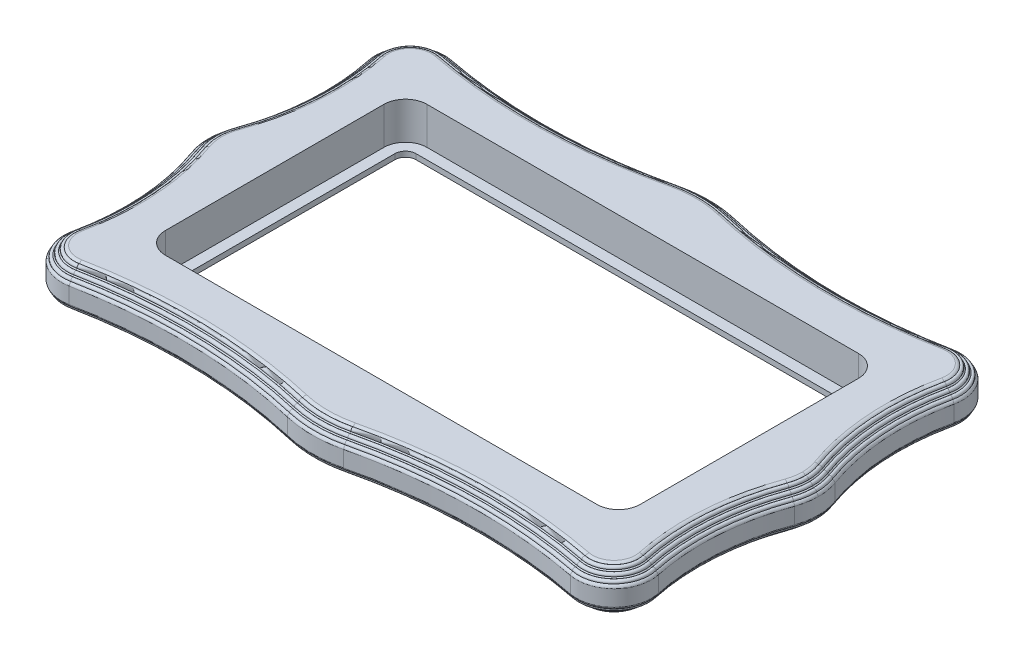
from build123d import *

# Parameters (mm, degrees)
SKETCH1_W                   = 115
SKETCH1_H                   = 75
BASE_DEPTH                  = 8
SCREEN_SIZE_CUT_DEPTH       = 8
DEVICE_SHAPE_CUT_DEPTH      = 7
SKETCH4_R                   = 3.625
SUPPORT_POLE_HOLE_CUT_DEPTH = 3


with BuildPart() as part:
    # Sketch1 → Base (new body)
    with BuildSketch(Plane(origin=(0, 0, 0), x_dir=(1, 0, 0), z_dir=(0, 1, 0))):
        Rectangle(SKETCH1_W, SKETCH1_H)
    extrude(amount=BASE_DEPTH)

    # Sweep Cut: sweep along a path in Path
    with BuildLine(Plane(origin=(0, 8, 0), x_dir=(1, 0, 0), z_dir=(0, 1, 0))) as sweep_cut_path:
        ThreePointArc((4.590909091, 33.967813339), (0, 34.5), (-4.590909091, 33.967813339))
        ThreePointArc((-4.590909091, 33.967813339), (-26.049498342, 31.269257036), (-47.596562859, 33.134000848))
        ThreePointArc((-47.596562859, 33.134000848), (-51.212709806, 32.011484521), (-52.272742782, 28.376530361))
        ThreePointArc((-52.272742782, 28.376530361), (-51.358336789, 15.452972347), (-54.016508134, 2.772727273))
        ThreePointArc((-54.016508134, 2.772727273), (-54.5, 0), (-54.016508134, -2.772727273))
        ThreePointArc((-54.016508134, -2.772727273), (-51.358336789, -15.452972347), (-52.272742782, -28.376530361))
        ThreePointArc((-52.272742782, -28.376530361), (-51.212709806, -32.011484521), (-47.596562859, -33.134000848))
        ThreePointArc((-47.596562859, -33.134000848), (-26.049498342, -31.269257036), (-4.590909091, -33.967813339))
        ThreePointArc((-4.590909091, -33.967813339), (0, -34.5), (4.590909091, -33.967813339))
        ThreePointArc((4.590909091, -33.967813339), (26.049498342, -31.269257036), (47.596562859, -33.134000848))
        ThreePointArc((47.596562859, -33.134000848), (51.212709806, -32.011484521), (52.272742782, -28.376530361))
        ThreePointArc((52.272742782, -28.376530361), (51.358336789, -15.452972347), (54.016508134, -2.772727273))
        ThreePointArc((54.016508134, -2.772727273), (54.5, 0), (54.016508134, 2.772727273))
        ThreePointArc((54.016508134, 2.772727273), (51.358336789, 15.452972347), (52.272742782, 28.376530361))
        ThreePointArc((52.272742782, 28.376530361), (51.212709806, 32.011484521), (47.596562859, 33.134000848))
        ThreePointArc((47.596562859, 33.134000848), (26.049498342, 31.269257036), (4.590909091, 33.967813339))
    # Profile → Sweep Cut (sweep, cut)
    with BuildSketch(Plane.XY):
        with BuildLine():
            Line((54.5, 8), (57.5, 8))
            Line((57.5, 8), (67.5, 8))
            Line((67.5, 8), (67.5, 5.5))
            Line((67.5, 5.5), (67.5, 2.5))
            Line((67.5, 2.5), (67.5, 0))
            Line((67.5, 0), (57.5, 0))
            Line((57.5, 0), (54.5, 0))
            ThreePointArc((54.5, 0), (54.822104928, 0.071374349), (55.083908139, 0.272135304))
            ThreePointArc((55.083908139, 0.272135304), (55.499671916, 0.325393701), (55.62703102, 0.724737705))
            ThreePointArc((55.62703102, 0.724737705), (55.738140605, 0.801731274), (55.833908139, 0.897135304))
            ThreePointArc((55.833908139, 0.897135304), (56.249671916, 0.950393701), (56.37703102, 1.349737705))
            ThreePointArc((56.37703102, 1.349737705), (56.488140605, 1.426731274), (56.583908139, 1.522135304))
            ThreePointArc((56.583908139, 1.522135304), (56.999671916, 1.575393701), (57.12703102, 1.974737705))
            ThreePointArc((57.12703102, 1.974737705), (57.371711227, 2.196046265), (57.5, 2.5))
            Line((57.5, 2.5), (57.5, 5.5))
            ThreePointArc((57.5, 5.5), (57.371711227, 5.803953735), (57.12703102, 6.025262295))
            ThreePointArc((57.12703102, 6.025262295), (56.999671916, 6.424606299), (56.583908139, 6.477864696))
            ThreePointArc((56.583908139, 6.477864696), (56.488140605, 6.573268726), (56.37703102, 6.650262295))
            ThreePointArc((56.37703102, 6.650262295), (56.249671916, 7.049606299), (55.833908139, 7.102864696))
            ThreePointArc((55.833908139, 7.102864696), (55.738140605, 7.198268726), (55.62703102, 7.275262295))
            ThreePointArc((55.62703102, 7.275262295), (55.499671916, 7.674606299), (55.083908139, 7.727864696))
            ThreePointArc((55.083908139, 7.727864696), (54.822104928, 7.928625651), (54.5, 8))
        make_face()
    sweep(path=sweep_cut_path.line, mode=Mode.SUBTRACT)

    # Sketch10 → Screen Size Cut (cut)
    with BuildSketch(Plane(origin=(0, 8, 0), x_dir=(1, 0, 0), z_dir=(0, 1, 0))):
        with BuildLine():
            Line((40.5, -22.5), (-40.5, -22.5))
            ThreePointArc((-40.5, -22.5), (-41.914213562, -21.914213562), (-42.5, -20.5))
            Line((-42.5, -20.5), (-42.5, 20.5))
            ThreePointArc((-42.5, 20.5), (-41.914213562, 21.914213562), (-40.5, 22.5))
            Line((-40.5, 22.5), (40.5, 22.5))
            ThreePointArc((40.5, 22.5), (41.914213562, 21.914213562), (42.5, 20.5))
            Line((42.5, 20.5), (42.5, -20.5))
            ThreePointArc((42.5, -20.5), (41.914213562, -21.914213562), (40.5, -22.5))
        make_face()
    extrude(amount=-SCREEN_SIZE_CUT_DEPTH, mode=Mode.SUBTRACT)

    # Sketch12 → Device Shape Cut (cut)
    with BuildSketch(Plane(origin=(0, 8, 0), x_dir=(1, 0, 0), z_dir=(0, 1, 0))):
        with BuildLine():
            Line((44.541666667, -20.5), (44.541666667, 20.5))
            ThreePointArc((44.541666667, 20.5), (43.357889907, 23.357889907), (40.5, 24.541666667))
            Line((40.5, 24.541666667), (-40.5, 24.541666667))
            ThreePointArc((-40.5, 24.541666667), (-43.357889907, 23.357889907), (-44.541666667, 20.5))
            Line((-44.541666667, 20.5), (-44.541666667, -20.5))
            ThreePointArc((-44.541666667, -20.5), (-43.357889907, -23.357889907), (-40.5, -24.541666667))
            Line((-40.5, -24.541666667), (40.5, -24.541666667))
            ThreePointArc((40.5, -24.541666667), (43.357889907, -23.357889907), (44.541666667, -20.5))
        make_face()
    extrude(amount=-DEVICE_SHAPE_CUT_DEPTH, mode=Mode.SUBTRACT)

    # Sketch4 → Support Pole Hole Cut (cut)
    with BuildSketch(Plane(origin=(0, 0, 0), x_dir=(1, 0, 0), z_dir=(0, 1, 0))):
        with Locations(Location((-46.5, -26.5, 0), (0, 0, 270))):
            Circle(SKETCH4_R)
        with Locations(Location((46.5, -26.5, 0), (0, 0, 270))):
            Circle(SKETCH4_R)
        with Locations(Location((46.5, 26.5, 0), (0, 0, 270))):
            Circle(SKETCH4_R)
        with Locations(Location((-46.5, 26.5, 0), (0, 0, 270))):
            Circle(SKETCH4_R)
    extrude(amount=SUPPORT_POLE_HOLE_CUT_DEPTH, mode=Mode.SUBTRACT)


solid = part.part
